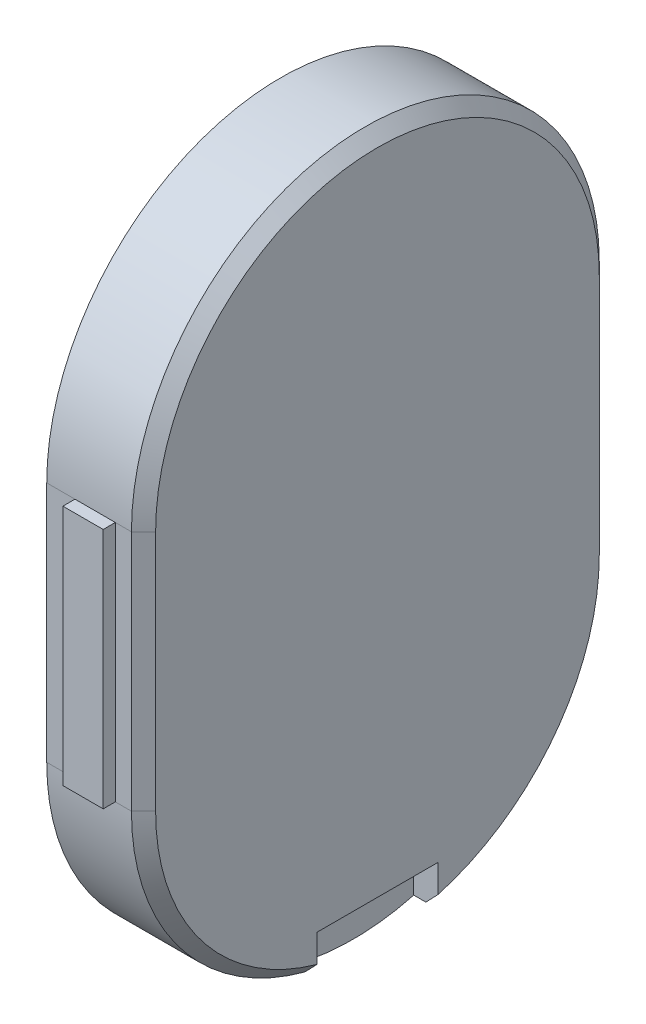
from build123d import *

# Parameters (mm, degrees)
BOSS_EXTRUDE1_START = 60.6
BOSS_EXTRUDE1_DEPTH = 2.4
CHAMFER1_SIZE       = 0.3
BOSS_EXTRUDE2_START = 61.3
SKETCH2_W           = 1
SKETCH2_H           = 6
BOSS_EXTRUDE2_DEPTH = 0.31
BOSS_EXTRUDE3_START = 73.19
SKETCH3_W           = 1
SKETCH3_H           = 6
BOSS_EXTRUDE3_DEPTH = 0.31
BOSS_EXTRUDE4_START = 65.9
SKETCH4_W           = 0.7
SKETCH4_H           = 1.3
BOSS_EXTRUDE4_DEPTH = 3


with BuildPart() as part:
    # Sketch1 → Boss-Extrude1 (new body)
    with BuildSketch(Plane(origin=(0, 0, 0), x_dir=(0, 0, -1), z_dir=(1, 0, 0)).offset(BOSS_EXTRUDE1_START)):
        with BuildLine():
            Line((-73.2, 110), (-73.2, 116))
            ThreePointArc((-73.2, 116), (-71.501219331, 120.101219331), (-67.4, 121.8))
            ThreePointArc((-67.4, 121.8), (-63.298780669, 120.101219331), (-61.6, 116))
            Line((-61.6, 116), (-61.6, 110))
            ThreePointArc((-61.6, 110), (-63.298780669, 105.898780669), (-67.4, 104.2))
            ThreePointArc((-67.4, 104.2), (-71.501219331, 105.898780669), (-73.2, 110))
        make_face()
    extrude(amount=BOSS_EXTRUDE1_DEPTH)

    # Chamfer1
    chamfer1_edges = [part.edges().sort_by_distance(p)[0] for p in [
        (63, 104.2, 67.4),
        (63, 113, 61.6),
        (63, 113, 73.2),
        (63, 121.8, 67.4),
    ]]
    chamfer(chamfer1_edges, length=CHAMFER1_SIZE)

    # Sketch2 → Boss-Extrude2 (add)
    with BuildSketch(Plane.XY.offset(BOSS_EXTRUDE2_START)):
        with Locations((61.8, 113)):
            Rectangle(SKETCH2_W, SKETCH2_H)
    extrude(amount=BOSS_EXTRUDE2_DEPTH)

    # Sketch3 → Boss-Extrude3 (add)
    with BuildSketch(Plane.XY.offset(BOSS_EXTRUDE3_START)):
        with Locations((61.8, 113)):
            Rectangle(SKETCH3_W, SKETCH3_H)
    extrude(amount=BOSS_EXTRUDE3_DEPTH)


with BuildPart() as body_2:
    # Sketch4 → Boss-Extrude4 (new body)
    with BuildSketch(Plane.XY.offset(BOSS_EXTRUDE4_START)):
        with Locations((62.75, 104.75)):
            Rectangle(SKETCH4_W, SKETCH4_H)
    extrude(amount=BOSS_EXTRUDE4_DEPTH)


with BuildPart() as part_1:
    add(part.part)

    # Combine1: cut body 2
    add(body_2.part, mode=Mode.SUBTRACT)


solid = part_1.part
